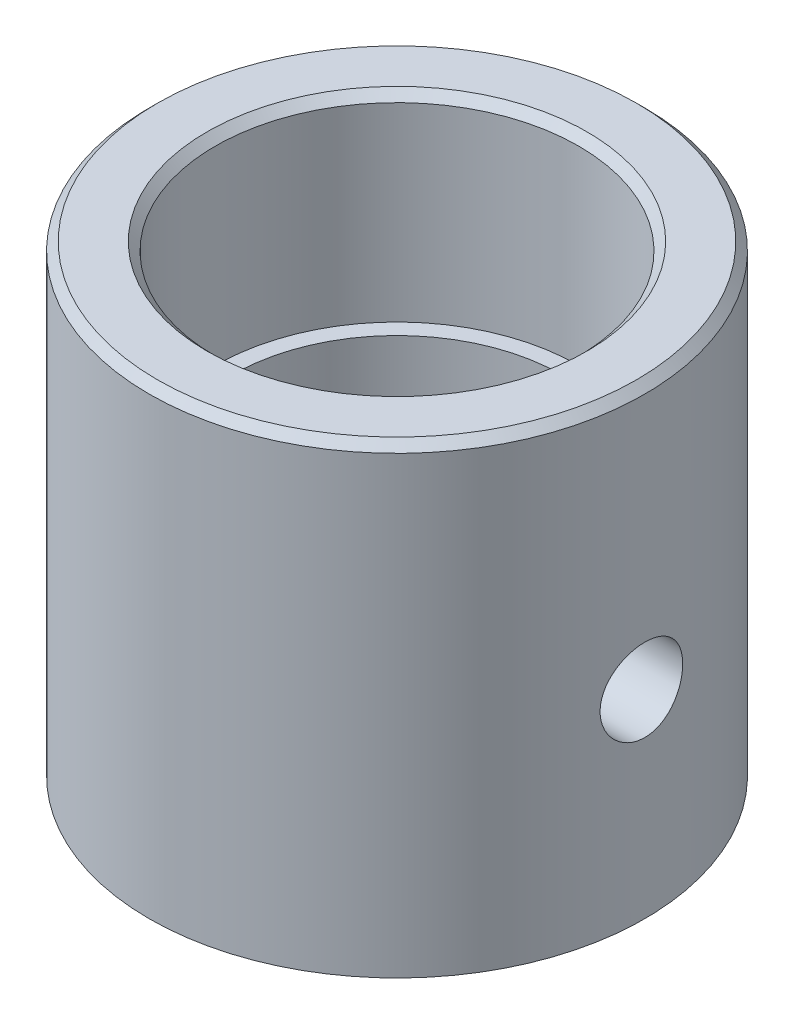
from build123d import *

# Parameters (mm, degrees)
SKETCH1_R               = 15
BOSS_EXTRUDE1_DEPTH     = 28
SKETCH2_R               = 10
CUT_EXTRUDE1_DEPTH      = 27
SKETCH3_R               = 11
CUT_EXTRUDE2_DEPTH      = 12
CUT_EXTRUDE3_DEPTH      = 36.128336141
CUT_EXTRUDE3_DEPTH_BACK = 36.128336141
SKETCH4_R               = 2.5
CHAMFER1_SIZE           = 0.5


with BuildPart() as part:
    # Sketch1 → Boss-Extrude1 (new body)
    with BuildSketch(Plane(origin=(0, 0, 0), x_dir=(1, 0, 0), z_dir=(0, 1, 0))):
        with Locations(Location((0, 0, 0), (0, 0, 270))):
            Circle(SKETCH1_R)
    extrude(amount=BOSS_EXTRUDE1_DEPTH)

    # Sketch2 → Cut-Extrude1 (cut)
    with BuildSketch(Plane(origin=(0, 28, 0), x_dir=(1, 0, 0), z_dir=(0, 1, 0))):
        with Locations(Location((0, 0, 0), (0, 0, 270))):
            Circle(SKETCH2_R)
    extrude(amount=-CUT_EXTRUDE1_DEPTH, mode=Mode.SUBTRACT)

    # Sketch3 → Cut-Extrude2 (cut)
    with BuildSketch(Plane(origin=(0, 28, 0), x_dir=(1, 0, 0), z_dir=(0, 1, 0))):
        with Locations(Location((0, 0, 0), (0, 0, 270))):
            Circle(SKETCH3_R)
    extrude(amount=-CUT_EXTRUDE2_DEPTH, mode=Mode.SUBTRACT)

    # Sketch4 → Cut-Extrude3 (cut, two sides: drawn at the far end of the back side and taken through both)
    with BuildSketch(Plane(origin=(0, 0, 0), x_dir=(0, 0, -1), z_dir=(1, 0, 0)).offset(-CUT_EXTRUDE3_DEPTH_BACK)):
        with Locations((0, 12)):
            Circle(SKETCH4_R)
    extrude(amount=CUT_EXTRUDE3_DEPTH + CUT_EXTRUDE3_DEPTH_BACK, mode=Mode.SUBTRACT)

    # Chamfer1
    chamfer1_edges = [part.edges().sort_by_distance(p)[0] for p in [
        (0, 28, -11),
        (0, 28, -15),
    ]]
    chamfer(chamfer1_edges, length=CHAMFER1_SIZE)


solid = part.part
